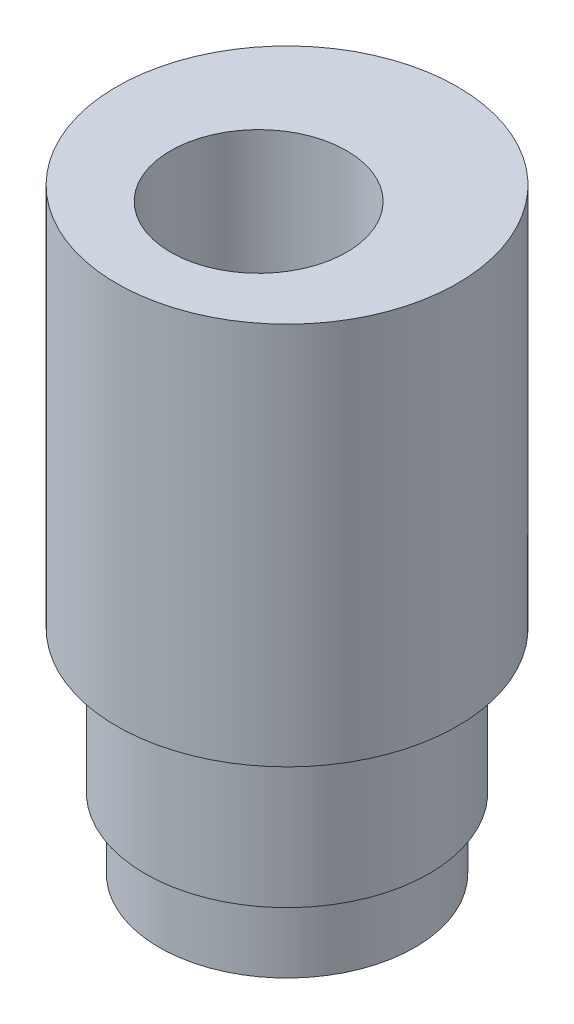
from build123d import *

# Parameters (mm, degrees)
SKETCH5_R          = 3.1
CUT_EXTRUDE1_DEPTH = 23.649503306


with BuildPart() as part:
    # Sketch4 → Revolve1 (revolve)
    with BuildSketch(Plane(origin=(0, 0, 0), x_dir=(0, 0, -1), z_dir=(1, 0, 0)), mode=Mode.PRIVATE) as revolve1_sk:
        Polygon((-4.5, 2.5), (-5, 2.5), (-5, 7.5), (-6, 7.5), (-6, 21), (0, 21), (0, 0), (-4.5, 0), align=None)
    revolve(revolve1_sk.sketch.rotate(Axis((0, -43.514912226, 0), (0, 1, 0)), 180), axis=Axis((0, -43.514912226, 0), (0, 1, 0)))

    # Sketch5 → Cut-Extrude1 (cut, through all)
    with BuildSketch(Plane.XZ):
        with Locations(Location((0, 1, 0), (0, 0, 270))):
            Circle(SKETCH5_R)
    extrude(amount=-CUT_EXTRUDE1_DEPTH, mode=Mode.SUBTRACT)


solid = part.part
